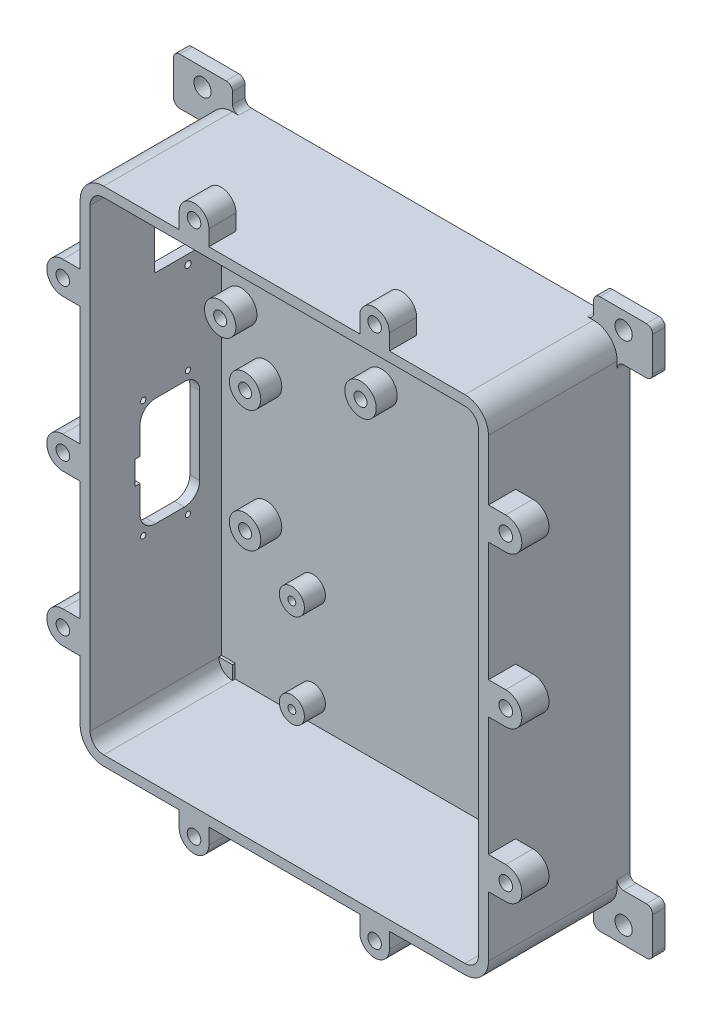
from build123d import *

# Parameters (mm, degrees)
SKETCH1_W                 = 165.1
SKETCH1_H                 = 203.2
BOSS_EXTRUDE1_DEPTH       = 57.15
FILLET1_R                 = 9.525
SHELL1_T                  = -4
SKETCH2_R                 = 5.08
BOSS_EXTRUDE2_DEPTH       = 8.5
SKETCH3_R                 = 1.5875
CUT_EXTRUDE1_DEPTH        = 5
SKETCH2_3_R               = 6.35
BOSS_EXTRUDE6_DEPTH       = 8.5
SKETCH13_R                = 2.625
CUT_EXTRUDE5_DEPTH        = 7
SKETCH4_R                 = 6.5
SKETCH4_R_2               = 2.75
BOSS_EXTRUDE3_DEPTH       = 11
CUT_EXTRUDE2_START        = -8
SKETCH4_6_R               = 2.75
CUT_EXTRUDE2_DEPTH        = 160.04398366
LPATTERN1_COUNT           = 2
LPATTERN1_PITCH           = 61.214
LPATTERN1_COUNT_DIR2      = 2
LPATTERN1_PITCH_DIR2      = 61.214
MIRROR1_COPY_1_SKETCH_R   = 6.5
MIRROR1_COPY_1_SKETCH_R_2 = 2.75
MIRROR1_COPY_1_DEPTH      = 11
MIRROR1_COPY_2_SKETCH_R   = 6.5
MIRROR1_COPY_2_SKETCH_R_2 = 2.75
MIRROR1_COPY_2_DEPTH      = 11
MIRROR1_COPY_3_SKETCH_R   = 6.5
MIRROR1_COPY_3_SKETCH_R_2 = 2.75
MIRROR1_COPY_3_DEPTH      = 11
MIRROR1_START             = -8
MIRROR1_COPY_4_SKETCH_R   = 2.75
MIRROR1_COPY_4_DEPTH      = 160.04398366
MIRROR1_COPY_5_SKETCH_R   = 2.75
MIRROR1_COPY_5_DEPTH      = 160.04398366
MIRROR1_COPY_6_SKETCH_R   = 2.75
MIRROR1_COPY_6_DEPTH      = 160.04398366
SKETCH12_R                = 6
SKETCH12_R_2              = 2.75
BOSS_EXTRUDE5_DEPTH       = 11
SKETCH12_3_R              = 2.75
CUT_EXTRUDE3_DEPTH        = 8
CUT_EXTRUDE6_DEPTH        = 4
SKETCH15_R                = 1.277999708
SKETCH15_R_2              = 1.27800008
SKETCH15_R_3              = 1.085
CUT_EXTRUDE7_DEPTH        = 4
SKETCH16_W                = 23.86362258
SKETCH16_H                = 19.05
SKETCH16_R                = 2
BOSS_EXTRUDE7_DEPTH       = 5.08
FILLET2_R                 = 2.54
M6_CLEARANCE_HOLE1_D      = 7


with BuildPart() as part:
    # Sketch1 → Boss-Extrude1 (new body)
    with BuildSketch(Plane.XY):
        Rectangle(SKETCH1_W, SKETCH1_H)
    extrude(amount=BOSS_EXTRUDE1_DEPTH)

    # Fillet1
    fillet1_edges = [part.edges().sort_by_distance(p)[0] for p in [
        (82.55, -101.6, 28.575),
        (-82.55, -101.6, 28.575),
        (-82.55, 101.6, 28.575),
        (82.55, 101.6, 28.575),
    ]]
    fillet(fillet1_edges, radius=FILLET1_R)

    # Shell1
    shell1_openings = [part.faces().sort_by_distance(p)[0] for p in [
        (0, 0, 57.15),
    ]]
    offset(amount=SHELL1_T, openings=shell1_openings, kind=Kind.INTERSECTION)

    # Sketch2 → Boss-Extrude2 (add)
    with BuildSketch(Plane.XY.offset(4)):
        with Locations((-41.6, -50.279)):
            Circle(SKETCH2_R)
        with Locations((-41.6, -88.279)):
            Circle(SKETCH2_R)
        with Locations((41.6, -88.279)):
            Circle(SKETCH2_R)
        with Locations((41.6, -50.279)):
            Circle(SKETCH2_R)
    extrude(amount=BOSS_EXTRUDE2_DEPTH)

    # Sketch3 → Cut-Extrude1 (cut)
    with BuildSketch(Plane.XY.offset(12.5)):
        with Locations((-41.6, -50.279)):
            Circle(SKETCH3_R)
        with Locations((-41.6, -88.279)):
            Circle(SKETCH3_R)
        with Locations((41.6, -88.279)):
            Circle(SKETCH3_R)
        with Locations((41.6, -50.279)):
            Circle(SKETCH3_R)
    extrude(amount=-CUT_EXTRUDE1_DEPTH, mode=Mode.SUBTRACT)

    # Sketch2<3> → Boss-Extrude6 (add)
    with BuildSketch(Plane.XY.offset(4)):
        with Locations((-60.516, -35.221)):
            Circle(SKETCH2_3_R)
        with Locations((-60.516, 14.011)):
            Circle(SKETCH2_3_R)
        with Locations((61.150666667, -35.221)):
            Circle(SKETCH2_3_R)
        with Locations((61.150666667, 14.011)):
            Circle(SKETCH2_3_R)
        with Locations((-13.83, 34.245)):
            Circle(SKETCH2_3_R)
        with Locations((-70.58, 34.245)):
            Circle(SKETCH2_3_R)
        with Locations((-70.58, 84.245)):
            Circle(SKETCH2_3_R)
        with Locations((-13.83, 84.245)):
            Circle(SKETCH2_3_R)
        with Locations((59.42, 84.245)):
            Circle(SKETCH2_3_R)
        with Locations((59.42, 34.245)):
            Circle(SKETCH2_3_R)
    extrude(amount=BOSS_EXTRUDE6_DEPTH)

    # Sketch13 → Cut-Extrude5 (cut)
    with BuildSketch(Plane.XY.offset(12.5)):
        with Locations((-60.516, -35.221)):
            Circle(SKETCH13_R)
        with Locations((61.150666667, -35.221)):
            Circle(SKETCH13_R)
        with Locations((61.150666667, 14.011)):
            Circle(SKETCH13_R)
        with Locations((-60.516, 14.011)):
            Circle(SKETCH13_R)
        with Locations((-13.83, 34.245)):
            Circle(SKETCH13_R)
        with Locations((-70.58, 34.245)):
            Circle(SKETCH13_R)
        with Locations((59.42, 34.245)):
            Circle(SKETCH13_R)
        with Locations((59.42, 84.245)):
            Circle(SKETCH13_R)
        with Locations((-13.83, 84.245)):
            Circle(SKETCH13_R)
        with Locations((-70.58, 84.245)):
            Circle(SKETCH13_R)
    extrude(amount=-CUT_EXTRUDE5_DEPTH, mode=Mode.SUBTRACT)

    # Sketch4 → Boss-Extrude3 (add)
    with BuildSketch(Plane.XY.offset(57.15)):
        with BuildLine():
            Line((-82.55, -6.5), (-82.55, 6.5))
            Line((-82.55, 6.5), (-89.55, 6.5))
            ThreePointArc((-89.55, 6.5), (-84.953805922, 4.596194078), (-83.05, 0))
            ThreePointArc((-83.05, 0), (-84.953805922, -4.596194078), (-89.55, -6.5))
            Line((-89.55, -6.5), (-82.55, -6.5))
        make_face()
        with Locations((-89.55, 0)):
            Circle(SKETCH4_R)
        with Locations((-89.55, 0)):
            Circle(SKETCH4_R_2)
    boss_extrude3 = extrude(amount=-BOSS_EXTRUDE3_DEPTH)

    # Sketch4<6> → Cut-Extrude2 (cut)
    with BuildSketch(Plane.XY.offset(57.15).offset(CUT_EXTRUDE2_START)):
        with Locations(Location((-89.55, 0, 0), (0, 0, 180))):
            Circle(SKETCH4_6_R)
    cut_extrude2 = extrude(amount=CUT_EXTRUDE2_DEPTH, mode=Mode.SUBTRACT)

    # LPattern1: Boss-Extrude3, Cut-Extrude2 2 × 2
    with Locations(*[Vector(0, 1, 0) * (i * LPATTERN1_PITCH) + Vector(0, -1, 0) * (j * LPATTERN1_PITCH_DIR2) for i in range(LPATTERN1_COUNT) for j in range(LPATTERN1_COUNT_DIR2) if (i, j) != (0, 0)]):
        add(boss_extrude3)
        add(cut_extrude2, mode=Mode.SUBTRACT)

    # Mirror1: Boss-Extrude3, Cut-Extrude2 across plane
    add(boss_extrude3.mirror(Plane(origin=(0, 0, 0), x_dir=(0, 0, 1), z_dir=(1, 0, 0))))
    add(cut_extrude2.mirror(Plane(origin=(0, 0, 0), x_dir=(0, 0, 1), z_dir=(1, 0, 0))), mode=Mode.SUBTRACT)

    # Mirror1 copy 1 sketch → Mirror1 copy 1 (add)
    with BuildSketch(Plane(origin=(0, -61.214, 57.15), x_dir=(-1, 0, 0), z_dir=(0, 0, 1))):
        with BuildLine():
            Line((-82.55, 6.5), (-82.55, -6.5))
            Line((-82.55, -6.5), (-89.55, -6.5))
            ThreePointArc((-89.55, -6.5), (-84.953805922, -4.596194078), (-83.05, 0))
            ThreePointArc((-83.05, 0), (-84.953805922, 4.596194078), (-89.55, 6.5))
            Line((-89.55, 6.5), (-82.55, 6.5))
        make_face()
        with Locations((-89.55, 0)):
            Circle(MIRROR1_COPY_1_SKETCH_R)
        with Locations((-89.55, 0)):
            Circle(MIRROR1_COPY_1_SKETCH_R_2)
    extrude(amount=-MIRROR1_COPY_1_DEPTH)

    # Mirror1 copy 2 sketch → Mirror1 copy 2 (add)
    with BuildSketch(Plane(origin=(0, 61.214, 57.15), x_dir=(-1, 0, 0), z_dir=(0, 0, 1))):
        with BuildLine():
            Line((-82.55, 6.5), (-82.55, -6.5))
            Line((-82.55, -6.5), (-89.55, -6.5))
            ThreePointArc((-89.55, -6.5), (-84.953805922, -4.596194078), (-83.05, 0))
            ThreePointArc((-83.05, 0), (-84.953805922, 4.596194078), (-89.55, 6.5))
            Line((-89.55, 6.5), (-82.55, 6.5))
        make_face()
        with Locations((-89.55, 0)):
            Circle(MIRROR1_COPY_2_SKETCH_R)
        with Locations((-89.55, 0)):
            Circle(MIRROR1_COPY_2_SKETCH_R_2)
    extrude(amount=-MIRROR1_COPY_2_DEPTH)

    # Mirror1 copy 3 sketch → Mirror1 copy 3 (add)
    with BuildSketch(Plane(origin=(0, 0, 57.15), x_dir=(-1, 0, 0), z_dir=(0, 0, 1))):
        with BuildLine():
            Line((-82.55, 6.5), (-82.55, -6.5))
            Line((-82.55, -6.5), (-89.55, -6.5))
            ThreePointArc((-89.55, -6.5), (-84.953805922, -4.596194078), (-83.05, 0))
            ThreePointArc((-83.05, 0), (-84.953805922, 4.596194078), (-89.55, 6.5))
            Line((-89.55, 6.5), (-82.55, 6.5))
        make_face()
        with Locations((-89.55, 0)):
            Circle(MIRROR1_COPY_3_SKETCH_R)
        with Locations((-89.55, 0)):
            Circle(MIRROR1_COPY_3_SKETCH_R_2)
    extrude(amount=-MIRROR1_COPY_3_DEPTH)

    # Mirror1 copy 4 sketch → Mirror1 copy 4 (cut)
    with BuildSketch(Plane(origin=(0, -61.214, 57.15), x_dir=(-1, 0, 0), z_dir=(0, 0, 1)).offset(MIRROR1_START)):
        with Locations((-89.55, 0)):
            Circle(MIRROR1_COPY_4_SKETCH_R)
    extrude(amount=MIRROR1_COPY_4_DEPTH, mode=Mode.SUBTRACT)

    # Mirror1 copy 5 sketch → Mirror1 copy 5 (cut)
    with BuildSketch(Plane(origin=(0, 61.214, 57.15), x_dir=(-1, 0, 0), z_dir=(0, 0, 1)).offset(MIRROR1_START)):
        with Locations((-89.55, 0)):
            Circle(MIRROR1_COPY_5_SKETCH_R)
    extrude(amount=MIRROR1_COPY_5_DEPTH, mode=Mode.SUBTRACT)

    # Mirror1 copy 6 sketch → Mirror1 copy 6 (cut)
    with BuildSketch(Plane(origin=(0, 0, 57.15), x_dir=(-1, 0, 0), z_dir=(0, 0, 1)).offset(MIRROR1_START)):
        with Locations((-89.55, 0)):
            Circle(MIRROR1_COPY_6_SKETCH_R)
    extrude(amount=MIRROR1_COPY_6_DEPTH, mode=Mode.SUBTRACT)

    # Sketch12 → Boss-Extrude5 (add)
    # profile 1 of 6: a face of its own
    with BuildSketch(Plane.XY.offset(57.15)):
        with Locations((-36.5125, -107.95)):
            Circle(SKETCH12_R)
        with Locations((-36.5125, -107.95)):
            Circle(SKETCH12_R_2, mode=Mode.SUBTRACT)
    # profile 2 of 6: a face of its own
    with BuildSketch(Plane.XY.offset(57.15)):
        with BuildLine():
            Line((-36.5125, -101.6), (-42.5125, -101.6))
            Line((-42.5125, -101.6), (-42.5125, -107.95))
            ThreePointArc((-42.5125, -107.95), (-36.5125, -101.95), (-30.5125, -107.95))
            Line((-30.5125, -107.95), (-30.5125, -101.6))
            Line((-30.5125, -101.6), (-36.5125, -101.6))
        make_face()
    # profile 3 of 6: a face of its own
    with BuildSketch(Plane.XY.offset(57.15)):
        with BuildLine():
            Line((42.5125, -101.6), (30.5125, -101.6))
            Line((30.5125, -101.6), (30.5125, -107.95))
            ThreePointArc((30.5125, -107.95), (36.5125, -101.95), (42.5125, -107.95))
            Line((42.5125, -107.95), (42.5125, -101.6))
        make_face()
    # profile 4 of 6: a face of its own
    with BuildSketch(Plane.XY.offset(57.15)):
        with Locations((36.5125, -107.95)):
            Circle(SKETCH12_R)
        with Locations((36.5125, -107.95)):
            Circle(SKETCH12_R_2, mode=Mode.SUBTRACT)
    # profile 5 of 6: a face of its own
    with BuildSketch(Plane.XY.offset(57.15)):
        with Locations((36.5125, -107.95)):
            Circle(SKETCH12_R_2)
    # profile 6 of 6: a face of its own
    with BuildSketch(Plane.XY.offset(57.15)):
        with Locations((-36.5125, -107.95)):
            Circle(SKETCH12_R_2)
    boss_extrude5 = extrude(amount=-BOSS_EXTRUDE5_DEPTH)

    # Sketch12<3> → Cut-Extrude3 (cut)
    with BuildSketch(Plane.XY.offset(57.15)):
        with Locations((-36.5125, -107.95)):
            Circle(SKETCH12_3_R)
        with Locations((36.5125, -107.95)):
            Circle(SKETCH12_3_R)
    cut_extrude3 = extrude(amount=-CUT_EXTRUDE3_DEPTH, mode=Mode.SUBTRACT)

    # Mirror2: Boss-Extrude5, Cut-Extrude3 across plane
    add(boss_extrude5.mirror(Plane.ZX))
    add(cut_extrude3.mirror(Plane.ZX), mode=Mode.SUBTRACT)

    # Sketch14 → Cut-Extrude6 (cut)
    with BuildSketch(Plane.ZY.offset(82.55)):
        with BuildLine():
            Line((13.001198711, 71.173698477), (13.001198711, 55.924178477))
            ThreePointArc((13.001198711, 55.924178477), (13.191649597, 55.464389363), (13.651438711, 55.273938477))
            Line((13.651438711, 55.273938477), (30.400958711, 55.273938477))
            ThreePointArc((30.400958711, 55.273938477), (30.860747824, 55.464389363), (31.051198711, 55.924178477))
            Line((31.051198711, 55.924178477), (31.051198711, 71.173698477))
            ThreePointArc((31.051198711, 71.173698477), (30.860747824, 71.63348759), (30.400958711, 71.823938477))
            Line((30.400958711, 71.823938477), (13.651438711, 71.823938477))
            ThreePointArc((13.651438711, 71.823938477), (13.191649597, 71.63348759), (13.001198711, 71.173698477))
        make_face()
        with BuildLine():
            Line((19.002558116, 11.273530358), (30.710277026, 11.273530358))
            ThreePointArc((30.710277026, 11.273530358), (35.094438064, 9.457551397), (36.910417026, 5.073390358))
            Line((36.910417026, 5.073390358), (36.910417026, -5.924771289))
            Line((36.910417026, -5.924771289), (38.910417196, -5.924771289))
            Line((38.910417196, -5.924771289), (38.910417196, -15.432771289))
            Line((38.910417196, -15.432771289), (36.910417026, -15.432771289))
            Line((36.910417026, -15.432771289), (36.910417026, -26.430980176))
            ThreePointArc((36.910417026, -26.430980176), (35.094438064, -30.815141214), (30.710277026, -32.631120176))
            Line((30.710277026, -32.631120176), (19.002558116, -32.631120176))
            ThreePointArc((19.002558116, -32.631120176), (14.618397078, -30.815141214), (12.802418116, -26.430980176))
            Line((12.802418116, -26.430980176), (12.802418116, 5.073390358))
            ThreePointArc((12.802418116, 5.073390358), (14.618397078, 9.457551397), (19.002558116, 11.273530358))
        make_face()
    extrude(amount=-CUT_EXTRUDE6_DEPTH, mode=Mode.SUBTRACT)

    # Sketch15 → Cut-Extrude7 (cut)
    with BuildSketch(Plane.ZY.offset(82.55)):
        with Locations(Location((26.526199243, 75.548938622, 0), (0, 0, 270))):
            Circle(SKETCH15_R)
        with Locations(Location((17.526199243, 51.548938622, 0), (0, 0, 270))):
            Circle(SKETCH15_R_2)
        with Locations(Location((35.656417868, 13.021192217, 0), (0, 0, 270))):
            Circle(SKETCH15_R_3)
        with Locations(Location((17.556417868, 14.521192217, 0), (0, 0, 270))):
            Circle(SKETCH15_R_3)
        with Locations(Location((35.656417868, -34.378807783, 0), (0, 0, 270))):
            Circle(SKETCH15_R_3)
        with Locations(Location((17.556417868, -35.878807783, 0), (0, 0, 270))):
            Circle(SKETCH15_R_3)
    extrude(amount=-CUT_EXTRUDE7_DEPTH, mode=Mode.SUBTRACT)

    # Sketch16 → Boss-Extrude7 (add)
    # profile 1 of 4: a face of its own
    with BuildSketch(Plane(origin=(0, 0, 0), x_dir=(-1, 0, 0), z_dir=(0, 0, -1))):
        with Locations((-84.95681129, 101.6)):
            Rectangle(SKETCH16_W, SKETCH16_H)
        with Locations((-85.148345763, 104.198345763)):
            Circle(SKETCH16_R, mode=Mode.SUBTRACT)
    # profile 2 of 4: a face of its own
    with BuildSketch(Plane(origin=(0, 0, 0), x_dir=(-1, 0, 0), z_dir=(0, 0, -1))):
        with Locations((-84.95681129, -101.6)):
            Rectangle(SKETCH16_W, SKETCH16_H)
        with Locations(Location((-85.148345763, -104.198345763, 0), (0, 0, 180))):
            Circle(SKETCH16_R, mode=Mode.SUBTRACT)
    # profile 3 of 4: a face of its own
    with BuildSketch(Plane(origin=(0, 0, 0), x_dir=(-1, 0, 0), z_dir=(0, 0, -1))):
        with Locations((84.95681129, -101.6)):
            Rectangle(SKETCH16_W, SKETCH16_H)
        with Locations((85.148345763, -104.198345763)):
            Circle(SKETCH16_R, mode=Mode.SUBTRACT)
    # profile 4 of 4: a face of its own
    with BuildSketch(Plane(origin=(0, 0, 0), x_dir=(-1, 0, 0), z_dir=(0, 0, -1))):
        with Locations((84.95681129, 101.6)):
            Rectangle(SKETCH16_W, SKETCH16_H)
        with Locations(Location((85.148345763, 104.198345763, 0), (0, 0, 180))):
            Circle(SKETCH16_R, mode=Mode.SUBTRACT)
    extrude(amount=-BOSS_EXTRUDE7_DEPTH)

    # Fillet2
    fillet2_edges = [part.edges().sort_by_distance(p)[0] for p in [
        (-73.025, 101.6, 2.54),
        (82.55, 92.075, 2.54),
        (-82.55, -92.075, 2.54),
        (73.025, -101.6, 2.54),
        (73.025, 101.6, 2.54),
        (73.025, 111.125, 2.54),
        (96.88862258, 92.075, 2.54),
        (96.88862258, 111.125, 2.54),
        (82.55, -92.075, 2.54),
        (96.88862258, -92.075, 2.54),
        (73.025, -111.125, 2.54),
        (96.88862258, -111.125, 2.54),
        (-73.025, -101.6, 2.54),
        (-73.025, -111.125, 2.54),
        (-96.88862258, -92.075, 2.54),
        (-96.88862258, -111.125, 2.54),
        (-82.55, 92.075, 2.54),
        (-96.88862258, 92.075, 2.54),
        (-73.025, 111.125, 2.54),
        (-96.88862258, 111.125, 2.54),
    ]]
    fillet(fillet2_edges, radius=FILLET2_R)

    # M6 Clearance Hole1 (through all)
    with Locations(Plane.XY.offset(5.08)):
        with Locations((-85.148345763, 104.198345763), (85.148345763, 104.198345763), (85.148345763, -104.198345763), (-85.148345763, -104.198345763)):
            Hole(M6_CLEARANCE_HOLE1_D / 2)


solid = part.part
